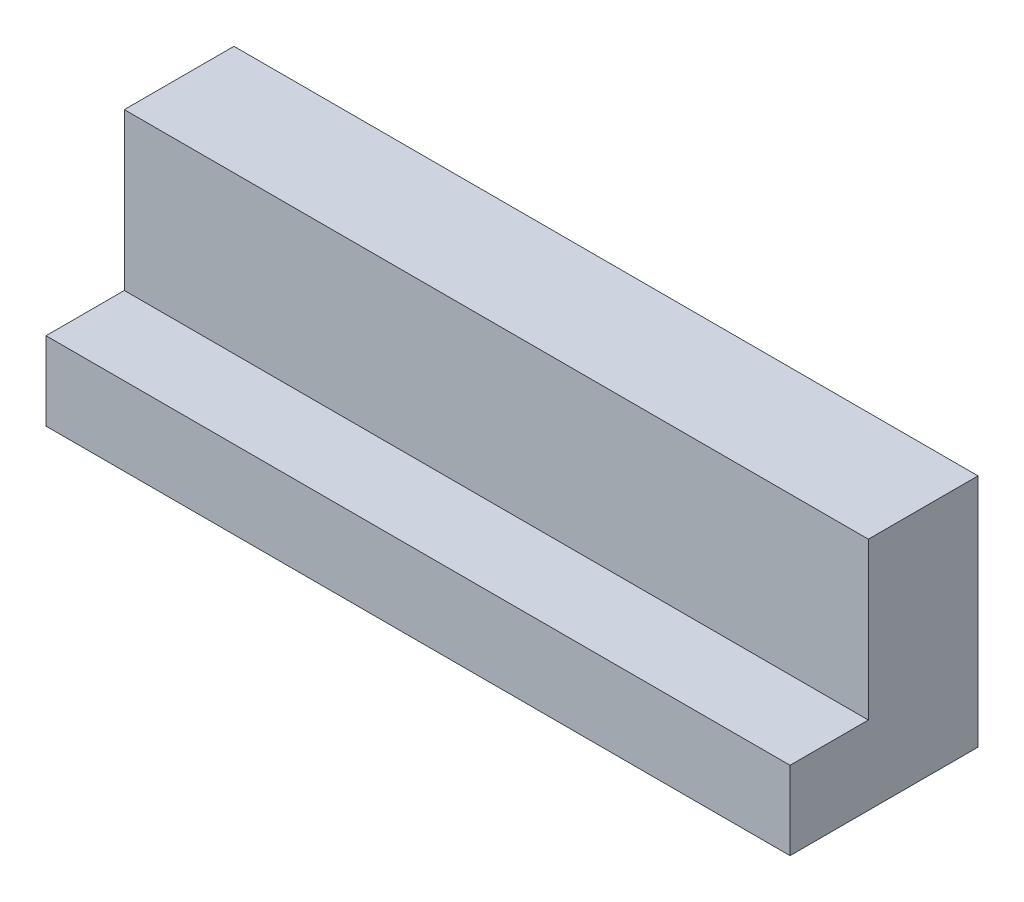
from build123d import *

# Parameters (mm, degrees)
SKETCH1_W           = 19
SKETCH1_H           = 6
BOSS_EXTRUDE1_DEPTH = 2.8
SKETCH2_W           = 19
SKETCH2_H           = 2
BOSS_EXTRUDE2_DEPTH = 2


with BuildPart() as part:
    # Sketch1 → Boss-Extrude1 (new body)
    with BuildSketch(Plane.XY):
        with Locations((30.28242964, 1.3)):
            Rectangle(SKETCH1_W, SKETCH1_H)
    extrude(amount=BOSS_EXTRUDE1_DEPTH)

    # Sketch2 → Boss-Extrude2 (add)
    with BuildSketch(Plane.XY.offset(2.8)):
        with Locations((30.28242964, -0.7)):
            Rectangle(SKETCH2_W, SKETCH2_H)
    extrude(amount=BOSS_EXTRUDE2_DEPTH)


solid = part.part
